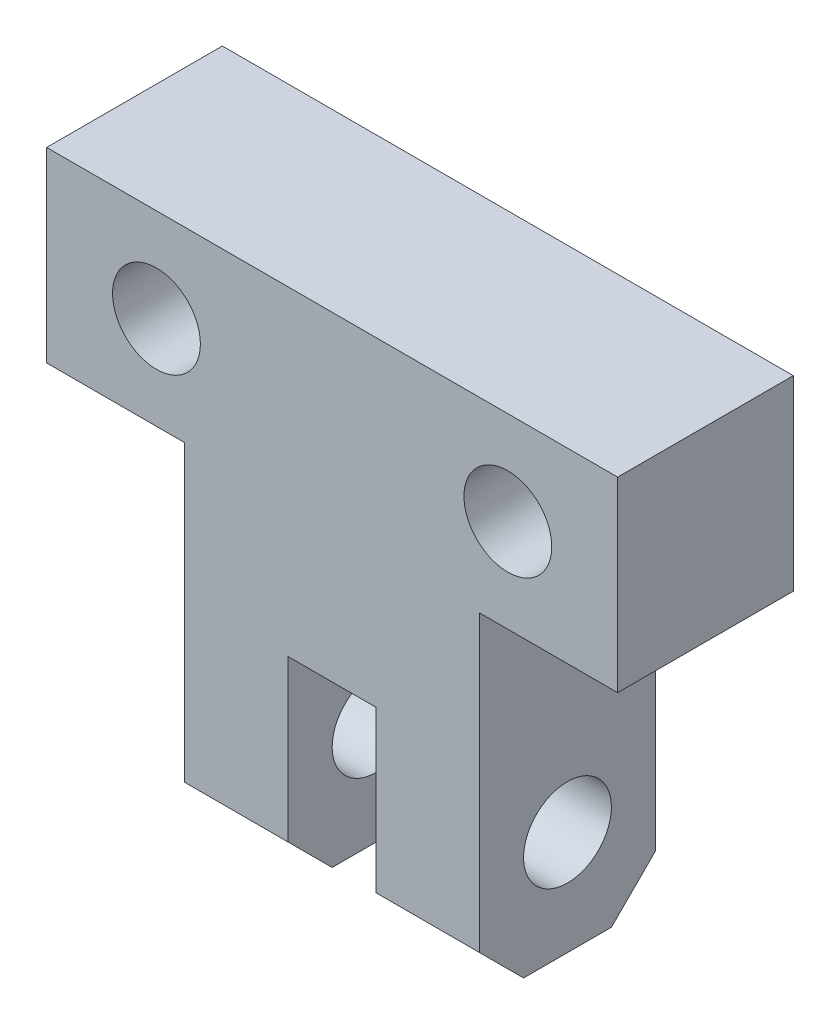
from build123d import *

# Parameters (mm, degrees)
EXTRUDE_1_DEPTH     = 8
SKETCH_2_R          = 2
CUT_EXTRUDE_2_DEPTH = 22.400934559
SKETCH_3_R          = 2
CUT_EXTRUDE_1_DEPTH = 27.033270693
CHAMFER_1_SIZE      = 2


with BuildPart() as part:
    # Эскиз1 → Вытянуть1 (new body)
    with BuildSketch(Plane.XY):
        Polygon((-13, 15), (13, 15), (13, 6.500000002), (6.716266963, 6.500000002), (6.716266963, -8.894499905), (2, -8.894499905), (2, 0.42128884), (-2, 0.42128884), (-2, -8.894499905), (-6.716266963, -8.894499905), (-6.716266963, 6.500000002), (-13, 6.500000002), align=None)
    extrude(amount=EXTRUDE_1_DEPTH)

    # Эскиз2 → Вытянуть2 (cut, through all)
    with BuildSketch(Plane.XY.offset(8)):
        with Locations((-8, 10.748498226)):
            Circle(SKETCH_2_R)
        with Locations((8, 10.750000001)):
            Circle(SKETCH_2_R)
    extrude(amount=-CUT_EXTRUDE_2_DEPTH, mode=Mode.SUBTRACT)

    # Эскиз3 → Вырез-Вытянуть1 (cut, through all)
    with BuildSketch(Plane(origin=(6.716266963, 0, 0), x_dir=(0, 0, -1), z_dir=(1, 0, 0))):
        with Locations((-4, -4.14834478)):
            Circle(SKETCH_3_R)
    extrude(amount=-CUT_EXTRUDE_1_DEPTH, mode=Mode.SUBTRACT)

    # Фаска1
    chamfer_1_edges = [part.edges().sort_by_distance(p)[0] for p in [
        (4.358133481, -8.894499905, 0),
        (-4.358133481, -8.894499905, 0),
        (-4.358133481, -8.894499905, 8),
        (4.358133481, -8.894499905, 8),
    ]]
    chamfer(chamfer_1_edges, length=CHAMFER_1_SIZE)


solid = part.part
